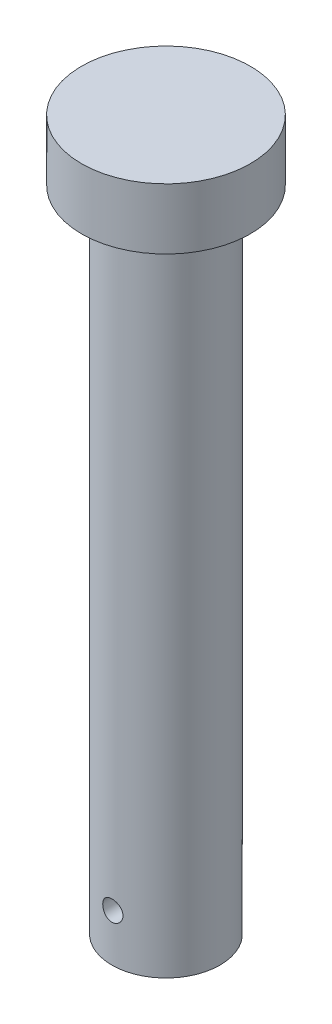
from build123d import *

# Parameters (mm, degrees)
SKETCH1_R           = 12.5
BOSS_EXTRUDE1_DEPTH = 9
SKETCH2_R           = 8
BOSS_EXTRUDE2_DEPTH = 96
SKETCH3_R           = 1.5
CUT_EXTRUDE1_DEPTH  = 48


with BuildPart() as part:
    # Sketch1 → Boss-Extrude1 (new body)
    with BuildSketch(Plane(origin=(0, 0, 0), x_dir=(1, 0, 0), z_dir=(0, 1, 0))):
        with Locations(Location((0, 0, 0), (0, 0, 270))):
            Circle(SKETCH1_R)
    extrude(amount=BOSS_EXTRUDE1_DEPTH)

    # Sketch2 → Boss-Extrude2 (add)
    with BuildSketch(Plane.XZ):
        with Locations(Location((0, 0, 0), (0, 0, 90))):
            Circle(SKETCH2_R)
    extrude(amount=BOSS_EXTRUDE2_DEPTH)

    # Sketch3 → Cut-Extrude1 (cut, symmetric)
    with BuildSketch(Plane.XY):
        with Locations((0, -89)):
            Circle(SKETCH3_R)
    extrude(amount=CUT_EXTRUDE1_DEPTH, both=True, mode=Mode.SUBTRACT)


solid = part.part
